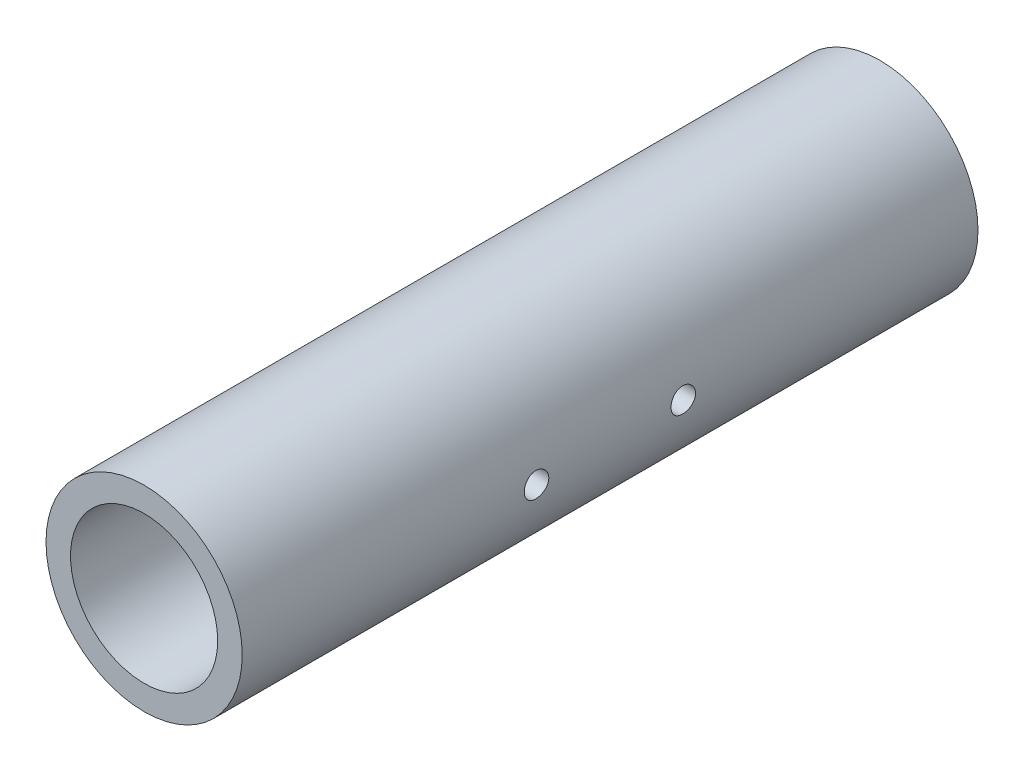
from build123d import *

# Parameters (mm, degrees)
SKETCH1_R               = 20
BOSS_EXTRUDE1_DEPTH     = 150
SKETCH2_R               = 15
CUT_EXTRUDE1_DEPTH      = 150
CUT_EXTRUDE2_DEPTH      = 153.643375225
CUT_EXTRUDE2_DEPTH_BACK = 153.643375225
SKETCH3_R               = 2.5


with BuildPart() as part:
    # Sketch1 → Boss-Extrude1 (new body)
    with BuildSketch(Plane.XY):
        Circle(SKETCH1_R)
    extrude(amount=BOSS_EXTRUDE1_DEPTH)

    # Sketch2 → Cut-Extrude1 (cut)
    with BuildSketch(Plane.XY.offset(150)):
        Circle(SKETCH2_R)
    extrude(amount=-CUT_EXTRUDE1_DEPTH, mode=Mode.SUBTRACT)

    # Sketch3 → Cut-Extrude2 (cut, two sides: drawn at the far end of the back side and taken through both)
    with BuildSketch(Plane(origin=(0, 0, 0), x_dir=(0, 0, -1), z_dir=(1, 0, 0)).offset(-CUT_EXTRUDE2_DEPTH_BACK)):
        with Locations((-90, 0)):
            Circle(SKETCH3_R)
        with Locations((-60.081308212, 0)):
            Circle(SKETCH3_R)
    extrude(amount=CUT_EXTRUDE2_DEPTH + CUT_EXTRUDE2_DEPTH_BACK, mode=Mode.SUBTRACT)


solid = part.part
